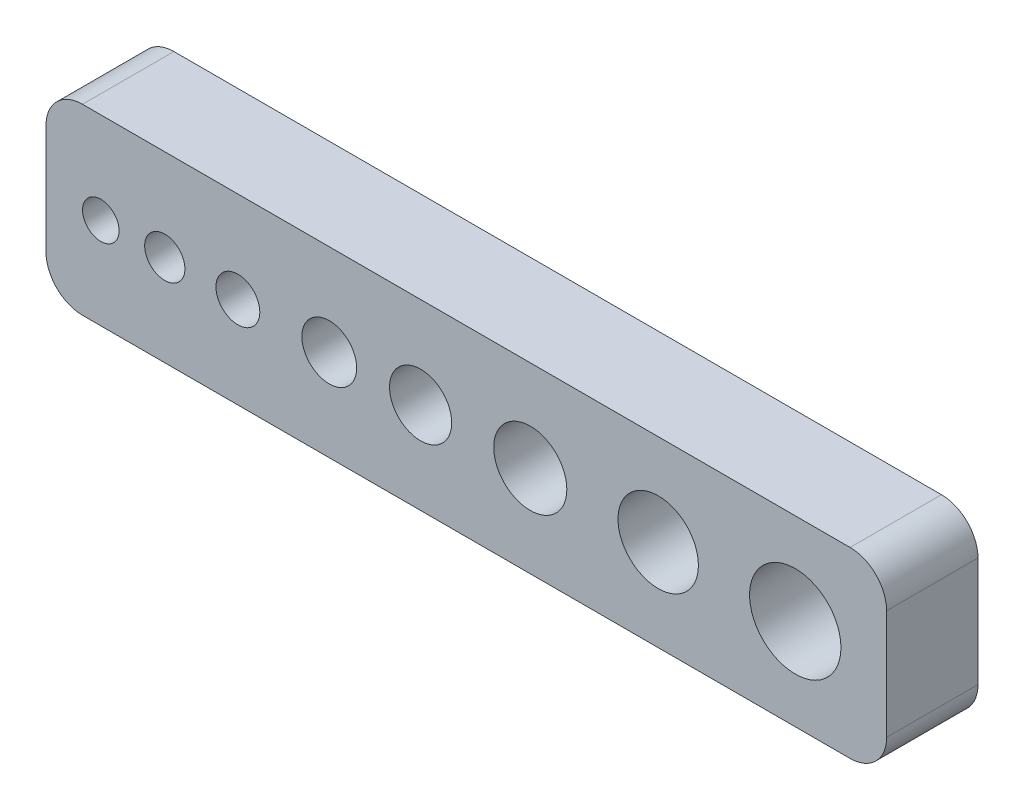
from build123d import *

# Parameters (mm, degrees)
SKETCH1_R           = 2
SKETCH1_R_2         = 2.2
SKETCH1_R_3         = 2.5
SKETCH1_R_4         = 1.7
SKETCH1_R_5         = 1.5
SKETCH1_R_6         = 1.2
SKETCH1_R_7         = 1.1
SKETCH1_R_8         = 1
BOSS_EXTRUDE1_DEPTH = 5


with BuildPart() as part:
    # Sketch1 → Boss-Extrude1 (new body)
    with BuildSketch(Plane.XY):
        with BuildLine():
            Line((-30.5, -3), (-30.5, 3))
            ThreePointArc((-30.5, 3), (-29.914213562, 4.414213562), (-28.5, 5))
            Line((-28.5, 5), (13.5, 5))
            ThreePointArc((13.5, 5), (14.914213562, 4.414213562), (15.5, 3))
            Line((15.5, 3), (15.5, -3))
            ThreePointArc((15.5, -3), (14.914213562, -4.414213562), (13.5, -5))
            Line((13.5, -5), (-28.5, -5))
            ThreePointArc((-28.5, -5), (-29.914213562, -4.414213562), (-30.5, -3))
        make_face()
        with Locations((-4, 0)):
            Circle(SKETCH1_R, mode=Mode.SUBTRACT)
        with Locations((3, 0)):
            Circle(SKETCH1_R_2, mode=Mode.SUBTRACT)
        with Locations((10.5, 0)):
            Circle(SKETCH1_R_3, mode=Mode.SUBTRACT)
        with Locations((-10, 0)):
            Circle(SKETCH1_R_4, mode=Mode.SUBTRACT)
        with Locations((-15, 0)):
            Circle(SKETCH1_R_5, mode=Mode.SUBTRACT)
        with Locations((-20, 0)):
            Circle(SKETCH1_R_6, mode=Mode.SUBTRACT)
        with Locations((-24, 0)):
            Circle(SKETCH1_R_7, mode=Mode.SUBTRACT)
        with Locations((-27.5, 0)):
            Circle(SKETCH1_R_8, mode=Mode.SUBTRACT)
    extrude(amount=BOSS_EXTRUDE1_DEPTH)


solid = part.part
